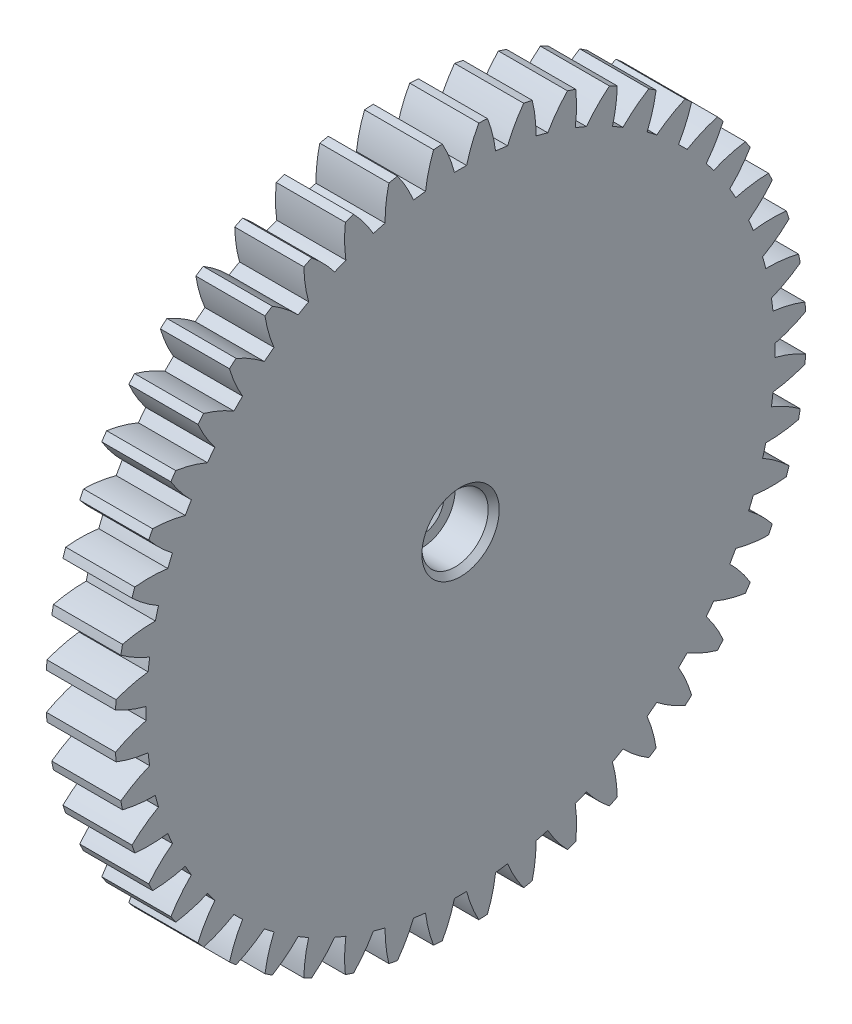
from build123d import *

# Parameters (mm, degrees)
BASPROSKE_W         = 5
BASPROSKE_H         = 25
TOOTHCUT_DEPTH      = 36.707142143
TEETHCUTS_COUNT     = 48
TEETHCUTS_ANGLE     = 352.5
BORSKE_R            = 0.5
BORE_DEPTH          = 50.0000508
SKETCH_2_R          = 1.2
CUT_EXTRUDE_1_DEPTH = 36.658310631
SKETCH_3_R          = 2.4
CUT_EXTRUDE_2_DEPTH = 2.8
CHAMFER_1_SIZE      = 0.4


with BuildPart() as part:
    # BasProSke → Base-Revolve (revolve)
    with BuildSketch(Plane(origin=(0, 0, 0), x_dir=(1, 0, 0), z_dir=(0, 1, 0)), mode=Mode.PRIVATE) as base_revolve_sk:
        with Locations((2.5, 12.5)):
            Rectangle(BASPROSKE_W, BASPROSKE_H)
    revolve(base_revolve_sk.sketch.rotate(Axis((-10, 0, 0), (1, 0, 0)), 180), axis=Axis((-10, 0, 0), (1, 0, 0)))

    # TooCutSke → ToothCut (cut, through all)
    with BuildSketch(Plane(origin=(0, 0, 0), x_dir=(0, 0, -1), z_dir=(1, 0, 0))):
        with BuildLine():
            ThreePointArc((0.439519311, 22.744753764), (0, 22.749), (-0.439519311, 22.744753764))
            ThreePointArc((-0.439519311, 22.744753764), (-0.815652087, 23.895542925), (-1.33363602, 24.989839138))
            ThreePointArc((-1.33363602, 24.989839138), (0, 25.0254), (1.33363602, 24.989839138))
            ThreePointArc((1.33363602, 24.989839138), (0.815652087, 23.895542925), (0.439519311, 22.744753764))
        make_face()
    toothcut = extrude(amount=TOOTHCUT_DEPTH, mode=Mode.SUBTRACT)

    # TeethCuts: ToothCut ×48 about axis
    teethcuts_axis = Axis((-10, 0, 0), (1, 0, 0))
    for i in range(1, TEETHCUTS_COUNT):
        add(toothcut.rotate(teethcuts_axis, i * TEETHCUTS_ANGLE / (TEETHCUTS_COUNT - 1)), mode=Mode.SUBTRACT)

    # BorSke → Bore (cut, symmetric)
    with BuildSketch(Plane(origin=(0, 0, 0), x_dir=(0, 0, -1), z_dir=(1, 0, 0))):
        with Locations(Location((0, 0, 0), (0, 0, 180))):
            Circle(BORSKE_R)
    extrude(amount=BORE_DEPTH, both=True, mode=Mode.SUBTRACT)

    # 草图2 → 切除-拉伸1 (cut, through all)
    with BuildSketch(Plane(origin=(5, 0, 0), x_dir=(0, 0, -1), z_dir=(1, 0, 0))):
        Circle(SKETCH_2_R)
    extrude(amount=-CUT_EXTRUDE_1_DEPTH, mode=Mode.SUBTRACT)

    # 草图3 → 切除-拉伸2 (cut)
    with BuildSketch(Plane(origin=(5, 0, 0), x_dir=(0, 0, -1), z_dir=(1, 0, 0))):
        Circle(SKETCH_3_R)
    extrude(amount=-CUT_EXTRUDE_2_DEPTH, mode=Mode.SUBTRACT)

    # 倒角1
    chamfer_1_edges = [part.edges().sort_by_distance(p)[0] for p in [
        (0, 0, 1.2),
        (5, 0, 2.4),
        (2.2, 0, 1.2),
    ]]
    chamfer(chamfer_1_edges, length=CHAMFER_1_SIZE)


solid = part.part
